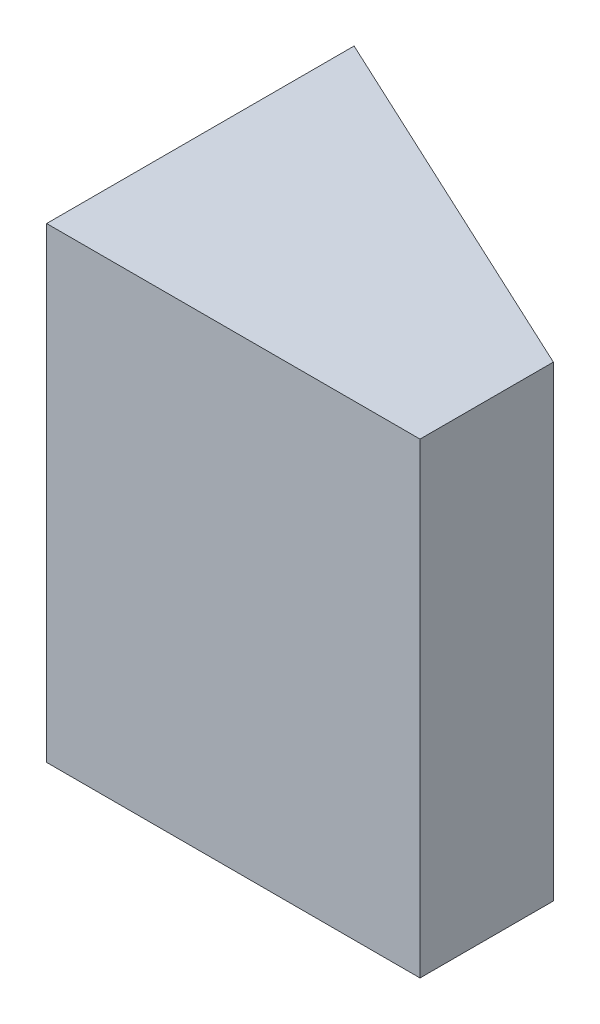
from build123d import *

# Parameters (mm, degrees)
SKETCH1_W           = 56
SKETCH1_H           = 20
BOSS_EXTRUDE1_DEPTH = 70


with BuildPart() as part:
    # Sketch1 → Boss-Extrude1 (new body)
    with BuildSketch(Plane(origin=(0, 0, 0), x_dir=(1, 0, 0), z_dir=(0, 1, 0))):
        Polygon((56, 20), (0, 46.113228857), (0, 20), align=None)
        with Locations((28, 10)):
            Rectangle(SKETCH1_W, SKETCH1_H)
    extrude(amount=BOSS_EXTRUDE1_DEPTH)


solid = part.part
